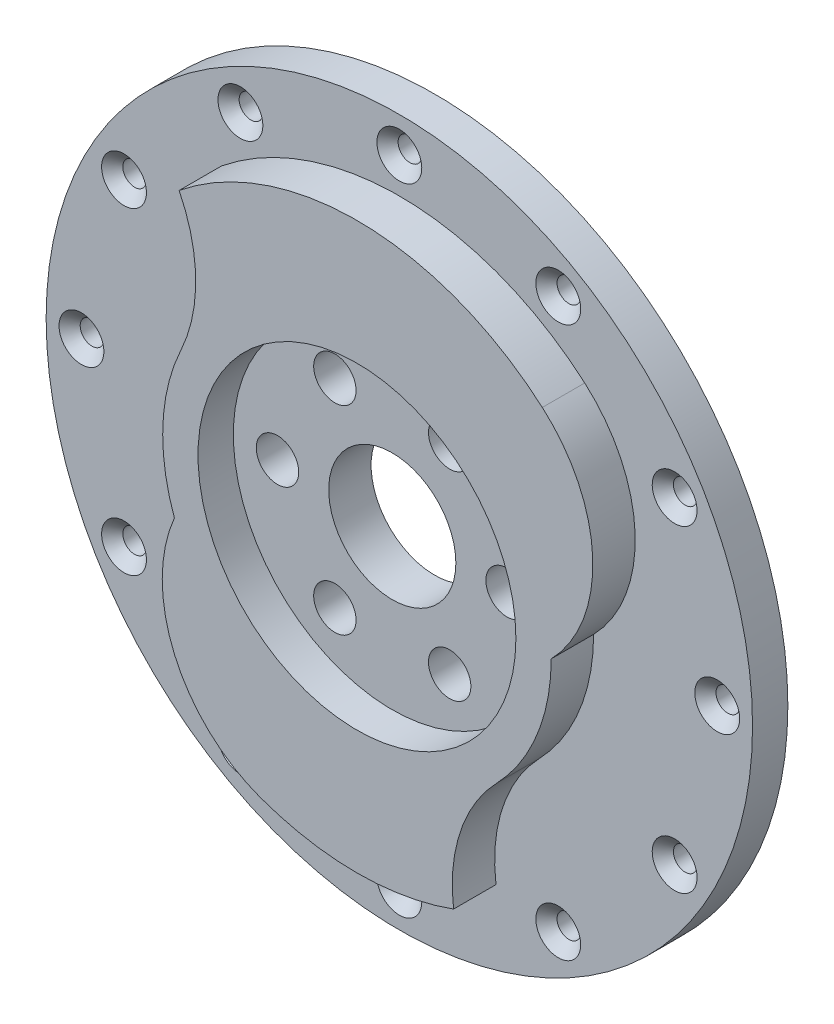
from build123d import *

# Parameters (mm, degrees)
SKETCH1_R               = 100
BOSS_EXTRUDE1_DEPTH     = 10
BOSS_EXTRUDE2_DEPTH     = 12
CUT_EXTRUDE1_START      = 12
SKETCH2_4_R             = 45
CUT_EXTRUDE1_DEPTH      = 10
CUT_EXTRUDE2_DEPTH      = 142.929559994
CUT_EXTRUDE2_DEPTH_BACK = 142.929559994
SKETCH2_5_R             = 18
SKETCH3_R               = 6
CUT_EXTRUDE3_DEPTH      = 142.929559994
CIRPATTERN1_COUNT       = 6
CIRPATTERN2_COUNT       = 12


with BuildPart() as part:
    # Sketch1 → Boss-Extrude1 (new body)
    with BuildSketch(Plane.XY):
        Circle(SKETCH1_R)
    extrude(amount=BOSS_EXTRUDE1_DEPTH)

    # Sketch2 → Boss-Extrude2 (add)
    with BuildSketch(Plane.XY.offset(10)):
        with BuildLine():
            ThreePointArc((-50.345631284, 62.171676917), (1.396192515, 79.987815613), (52.484722319, 60.376766418))
            ThreePointArc((52.484722319, 60.376766418), (66.748047509, 30.730196137), (55, 0))
            ThreePointArc((55, 0), (50.995112001, -20.603362638), (39.563689019, -38.206210375))
            ThreePointArc((39.563689019, -38.206210375), (29.24031903, -55.29718468), (27.361611466, -75.175409663))
            ThreePointArc((27.361611466, -75.175409663), (0, -80), (-27.361611466, -75.175409663))
            ThreePointArc((-27.361611466, -75.175409663), (-51.676872183, -52.237995658), (-51.683094143, -18.811107883))
            ThreePointArc((-51.683094143, -18.811107883), (-54.947652187, 2.399066305), (-49.846928287, 23.244004396))
            ThreePointArc((-49.846928287, 23.244004396), (-45.650267162, 42.764798591), (-50.345631284, 62.171676917))
        make_face()
    extrude(amount=BOSS_EXTRUDE2_DEPTH)

    # Sketch2<4> → Cut-Extrude1 (cut)
    with BuildSketch(Plane.XY.offset(10).offset(CUT_EXTRUDE1_START)):
        Circle(SKETCH2_4_R)
    extrude(amount=-CUT_EXTRUDE1_DEPTH, mode=Mode.SUBTRACT)

    # Sketch2<5> → Cut-Extrude2 (cut, two sides: drawn at the far end of the back side and taken through both)
    with BuildSketch(Plane.XY.offset(10).offset(-CUT_EXTRUDE2_DEPTH_BACK)):
        Circle(SKETCH2_5_R)
    extrude(amount=CUT_EXTRUDE2_DEPTH + CUT_EXTRUDE2_DEPTH_BACK, mode=Mode.SUBTRACT)

    # Sketch3 → Cut-Extrude3 (cut, through all)
    with BuildSketch(Plane.XY.offset(12)):
        with Locations((32.5, 0)):
            Circle(SKETCH3_R)
    cut_extrude3 = extrude(amount=-CUT_EXTRUDE3_DEPTH, mode=Mode.SUBTRACT)

    # CirPattern1: Cut-Extrude3 ×6 about axis
    cirpattern1_axis = Axis((0, 0, 0), (0, 0, 1))
    for i in range(1, CIRPATTERN1_COUNT):
        add(cut_extrude3.rotate(cirpattern1_axis, i * 360 / CIRPATTERN1_COUNT), mode=Mode.SUBTRACT)

    # Sketch5 → Cut-Revolve2 (revolve, cut)
    with BuildSketch(Plane(origin=(0, 0, 0), x_dir=(1, 0, 0), z_dir=(0, 1, 0))):
        Polygon((83.65, -10), (86.65, -7), (86.65, 0), (90, 0), (90, -10), align=None)
    cut_revolve2 = revolve(axis=Axis((90, 0, 0), (0, 0, 1)), mode=Mode.SUBTRACT)

    # CirPattern2: Cut-Revolve2 ×12 about axis
    cirpattern2_axis = Axis((0, 0, 0), (0, 0, 1))
    for i in range(1, CIRPATTERN2_COUNT):
        add(cut_revolve2.rotate(cirpattern2_axis, i * 360 / CIRPATTERN2_COUNT), mode=Mode.SUBTRACT)


solid = part.part
